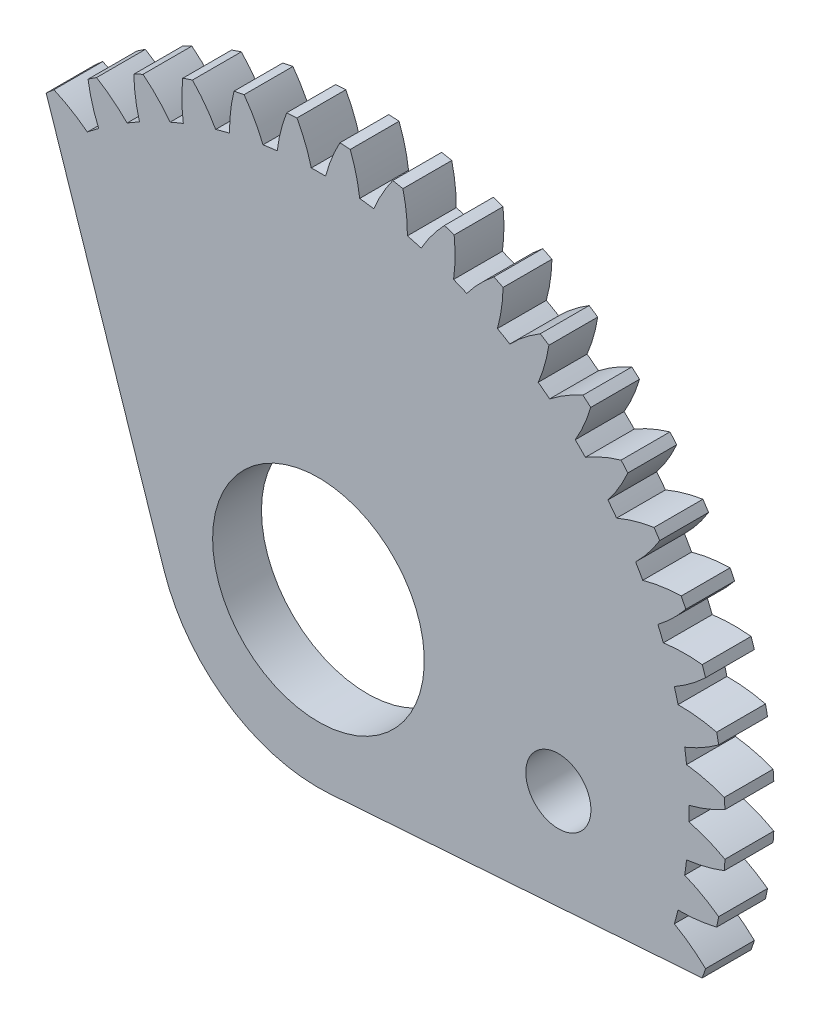
from build123d import *

# Parameters (mm, degrees)
EXTRUDE_1_DEPTH     = 5
CUT_EXTRUDE_1_DEPTH = 36.658310631
SKETCH_3_R          = 2.5
CUT_EXTRUDE_2_DEPTH = 36.658310631
SKETCH_4_R          = 3
CUT_EXTRUDE_3_DEPTH = 176.179925108
EXTRUDE_START       = -5
SKETCH_5_R          = 3
SKETCH_5_R_2        = 1.5
EXTRUDE_2_DEPTH     = 5
SKETCH_6_R          = 1.5
CUT_EXTRUDE_4_DEPTH = 36.531888735
SKETCH_7_R          = 10
SKETCH_7_R_2        = 2.5
EXTRUDE_3_DEPTH     = 5
EXTRUDE_4_DEPTH     = 5
SKETCH_9_R          = 6.5
CUT_EXTRUDE_5_DEPTH = 5
SKETCH_10_R         = 2
SKETCH_10_R_2       = 1.5
CUT_EXTRUDE_6_DEPTH = 5
SKETCH_11_R         = 6.5
SKETCH_11_R_2       = 2
CUT_EXTRUDE_7_DEPTH = 2


with BuildPart() as part:
    # 草图1 → 凸台-拉伸1 (new body)
    with BuildSketch(Plane.XY):
        with BuildLine():
            ThreePointArc((-24.965126848, 1.32001571), (-23.882431713, 0.810441639), (-22.744753764, 0.439519311))
            ThreePointArc((-22.744753764, 0.439519311), (-22.749, 0), (-22.744753764, -0.439519311))
            ThreePointArc((-22.744753764, -0.439519311), (-23.882431713, -0.810441639), (-24.965126848, -1.32001571))
            ThreePointArc((-24.965126848, -1.32001571), (-24.946473081, -1.635078231), (-24.923843351, -1.949880153))
            ThreePointArc((-24.923843351, -1.949880153), (-23.78389806, -2.313774674), (-22.607538024, -2.533026939))
            ThreePointArc((-22.607538024, -2.533026939), (-22.554379151, -2.969340347), (-22.49280046, -3.404545264))
            ThreePointArc((-22.49280046, -3.404545264), (-23.572330338, -3.920791071), (-24.579250102, -4.567325739))
            ThreePointArc((-24.579250102, -4.567325739), (-24.51963201, -4.87725805), (-24.456105984, -5.186413026))
            ThreePointArc((-24.456105984, -5.186413026), (-23.278415317, -5.398401661), (-22.083501041, -5.462232396))
            ThreePointArc((-22.083501041, -5.462232396), (-21.973846622, -5.887874457), (-21.855989105, -6.311318504))
            ThreePointArc((-21.855989105, -6.311318504), (-22.858899855, -6.964054681), (-23.772815573, -7.736487557))
            ThreePointArc((-23.772815573, -7.736487557), (-23.673253237, -8.035986633), (-23.569917864, -8.334204934))
            ThreePointArc((-23.569917864, -8.334204934), (-22.374632434, -8.390660498), (-21.181609233, -8.297977543))
            ThreePointArc((-21.181609233, -8.297977543), (-21.017335485, -8.705665403), (-20.845215716, -9.110103334))
            ThreePointArc((-20.845215716, -9.110103334), (-21.754347258, -9.888161384), (-22.559621578, -10.773275929))
            ThreePointArc((-22.559621578, -10.773275929), (-22.421818538, -11.057217255), (-22.280441914, -11.339396285))
            ThreePointArc((-22.280441914, -11.339396285), (-21.088013387, -11.239352809), (-19.917294218, -10.991741993))
            ThreePointArc((-19.917294218, -10.991741993), (-19.701211911, -11.3745), (-19.477774907, -11.753011771))
            ThreePointArc((-19.477774907, -11.753011771), (-20.277571748, -12.643078904), (-20.960426204, -13.625730562))
            ThreePointArc((-20.960426204, -13.625730562), (-20.786740308, -13.889255825), (-20.609741426, -14.150567422))
            ThreePointArc((-20.609741426, -14.150567422), (-19.440572584, -13.895736676), (-18.312188777, -13.49743469))
            ThreePointArc((-18.312188777, -13.49743469), (-18.047995138, -13.848713749), (-17.777063969, -14.194822917))
            ThreePointArc((-17.777063969, -14.194822917), (-18.453841363, -15.181669839), (-19.002592125, -16.245045168))
            ThreePointArc((-19.002592125, -16.245045168), (-18.795995187, -16.483645378), (-18.586402547, -16.719618427))
            ThreePointArc((-18.586402547, -16.719618427), (-17.460498194, -16.314360637), (-16.393756708, -15.772182537))
            ThreePointArc((-16.393756708, -15.772182537), (-16.085972165, -16.085972165), (-15.772182537, -16.393756708))
            ThreePointArc((-15.772182537, -16.393756708), (-16.314360637, -17.460498194), (-16.719618427, -18.586402547))
            ThreePointArc((-16.719618427, -18.586402547), (-16.483645378, -18.795995187), (-16.245045168, -19.002592125))
            ThreePointArc((-16.245045168, -19.002592125), (-15.181669839, -18.453841363), (-14.194822917, -17.777063969))
            ThreePointArc((-14.194822917, -17.777063969), (-13.848713749, -18.047995138), (-13.49743469, -18.312188777))
            ThreePointArc((-13.49743469, -18.312188777), (-13.895736676, -19.440572584), (-14.150567422, -20.609741426))
            ThreePointArc((-14.150567422, -20.609741426), (-13.889255825, -20.786740308), (-13.625730562, -20.960426204))
            ThreePointArc((-13.625730562, -20.960426204), (-12.643078904, -20.277571748), (-11.753011771, -19.477774907))
            ThreePointArc((-11.753011771, -19.477774907), (-11.3745, -19.701211911), (-10.991741993, -19.917294218))
            ThreePointArc((-10.991741993, -19.917294218), (-11.239352809, -21.088013387), (-11.339396285, -22.280441914))
            ThreePointArc((-11.339396285, -22.280441914), (-11.057217255, -22.421818538), (-10.773275929, -22.559621578))
            ThreePointArc((-10.773275929, -22.559621578), (-9.888161384, -21.754347258), (-9.110103334, -20.845215716))
            ThreePointArc((-9.110103334, -20.845215716), (-8.705665403, -21.017335485), (-8.297977543, -21.181609233))
            ThreePointArc((-8.297977543, -21.181609233), (-8.390660498, -22.374632434), (-8.334204934, -23.569917864))
            ThreePointArc((-8.334204934, -23.569917864), (-8.035986633, -23.673253237), (-7.736487557, -23.772815573))
            ThreePointArc((-7.736487557, -23.772815573), (-6.964054681, -22.858899855), (-6.311318504, -21.855989105))
            ThreePointArc((-6.311318504, -21.855989105), (-5.887874457, -21.973846622), (-5.462232396, -22.083501041))
            ThreePointArc((-5.462232396, -22.083501041), (-5.398401661, -23.278415317), (-5.186413026, -24.456105984))
            ThreePointArc((-5.186413026, -24.456105984), (-4.87725805, -24.51963201), (-4.567325739, -24.579250102))
            ThreePointArc((-4.567325739, -24.579250102), (-3.920791071, -23.572330338), (-3.404545264, -22.49280046))
            ThreePointArc((-3.404545264, -22.49280046), (-2.969340347, -22.554379151), (-2.533026939, -22.607538024))
            ThreePointArc((-2.533026939, -22.607538024), (-2.313774674, -23.78389806), (-1.949880153, -24.923843351))
            ThreePointArc((-1.949880153, -24.923843351), (-1.635078231, -24.946473081), (-1.32001571, -24.965126848))
            ThreePointArc((-1.32001571, -24.965126848), (-0.810441639, -23.882431713), (-0.439519311, -22.744753764))
            ThreePointArc((-0.439519311, -22.744753764), (0, -22.749), (0.439519311, -22.744753764))
            ThreePointArc((0.439519311, -22.744753764), (0.810441639, -23.882431713), (1.32001571, -24.965126848))
            ThreePointArc((1.32001571, -24.965126848), (1.635078231, -24.946473081), (1.949880153, -24.923843351))
            ThreePointArc((1.949880153, -24.923843351), (2.313774674, -23.78389806), (2.533026939, -22.607538024))
            ThreePointArc((2.533026939, -22.607538024), (2.969340347, -22.554379151), (3.404545264, -22.49280046))
            ThreePointArc((3.404545264, -22.49280046), (3.920791071, -23.572330338), (4.567325739, -24.579250102))
            ThreePointArc((4.567325739, -24.579250102), (4.87725805, -24.51963201), (5.186413026, -24.456105984))
            ThreePointArc((5.186413026, -24.456105984), (5.398401661, -23.278415317), (5.462232396, -22.083501041))
            ThreePointArc((5.462232396, -22.083501041), (5.887874457, -21.973846622), (6.311318504, -21.855989105))
            ThreePointArc((6.311318504, -21.855989105), (6.964054681, -22.858899855), (7.736487557, -23.772815573))
            ThreePointArc((7.736487557, -23.772815573), (8.035986633, -23.673253237), (8.334204934, -23.569917864))
            ThreePointArc((8.334204934, -23.569917864), (8.390660498, -22.374632434), (8.297977543, -21.181609233))
            ThreePointArc((8.297977543, -21.181609233), (8.705665403, -21.017335485), (9.110103334, -20.845215716))
            ThreePointArc((9.110103334, -20.845215716), (9.888161384, -21.754347258), (10.773275929, -22.559621578))
            ThreePointArc((10.773275929, -22.559621578), (11.057217255, -22.421818538), (11.339396285, -22.280441914))
            ThreePointArc((11.339396285, -22.280441914), (11.239352809, -21.088013387), (10.991741993, -19.917294218))
            ThreePointArc((10.991741993, -19.917294218), (11.3745, -19.701211911), (11.753011771, -19.477774907))
            ThreePointArc((11.753011771, -19.477774907), (12.643078904, -20.277571748), (13.625730562, -20.960426204))
            ThreePointArc((13.625730562, -20.960426204), (13.889255825, -20.786740308), (14.150567422, -20.609741426))
            ThreePointArc((14.150567422, -20.609741426), (13.895736676, -19.440572584), (13.49743469, -18.312188777))
            ThreePointArc((13.49743469, -18.312188777), (13.848713749, -18.047995138), (14.194822917, -17.777063969))
            ThreePointArc((14.194822917, -17.777063969), (15.181669839, -18.453841363), (16.245045168, -19.002592125))
            ThreePointArc((16.245045168, -19.002592125), (16.483645378, -18.795995187), (16.719618427, -18.586402547))
            ThreePointArc((16.719618427, -18.586402547), (16.314360637, -17.460498194), (15.772182537, -16.393756708))
            ThreePointArc((15.772182537, -16.393756708), (16.085972165, -16.085972165), (16.393756708, -15.772182537))
            ThreePointArc((16.393756708, -15.772182537), (17.460498194, -16.314360637), (18.586402547, -16.719618427))
            ThreePointArc((18.586402547, -16.719618427), (18.795995187, -16.483645378), (19.002592125, -16.245045168))
            ThreePointArc((19.002592125, -16.245045168), (18.453841363, -15.181669839), (17.777063969, -14.194822917))
            ThreePointArc((17.777063969, -14.194822917), (18.047995138, -13.848713749), (18.312188777, -13.49743469))
            ThreePointArc((18.312188777, -13.49743469), (19.440572584, -13.895736676), (20.609741426, -14.150567422))
            ThreePointArc((20.609741426, -14.150567422), (20.786740308, -13.889255825), (20.960426204, -13.625730562))
            ThreePointArc((20.960426204, -13.625730562), (20.277571748, -12.643078904), (19.477774907, -11.753011771))
            ThreePointArc((19.477774907, -11.753011771), (19.701211911, -11.3745), (19.917294218, -10.991741993))
            ThreePointArc((19.917294218, -10.991741993), (21.088013387, -11.239352809), (22.280441914, -11.339396285))
            ThreePointArc((22.280441914, -11.339396285), (22.421818538, -11.057217255), (22.559621578, -10.773275929))
            ThreePointArc((22.559621578, -10.773275929), (21.754347258, -9.888161384), (20.845215716, -9.110103334))
            ThreePointArc((20.845215716, -9.110103334), (21.017335485, -8.705665403), (21.181609233, -8.297977543))
            ThreePointArc((21.181609233, -8.297977543), (22.374632434, -8.390660498), (23.569917864, -8.334204934))
            ThreePointArc((23.569917864, -8.334204934), (23.673253237, -8.035986633), (23.772815573, -7.736487557))
            ThreePointArc((23.772815573, -7.736487557), (22.858899855, -6.964054681), (21.855989105, -6.311318504))
            ThreePointArc((21.855989105, -6.311318504), (21.973846622, -5.887874457), (22.083501041, -5.462232396))
            ThreePointArc((22.083501041, -5.462232396), (23.278415317, -5.398401661), (24.456105984, -5.186413026))
            ThreePointArc((24.456105984, -5.186413026), (24.51963201, -4.87725805), (24.579250102, -4.567325739))
            ThreePointArc((24.579250102, -4.567325739), (23.572330338, -3.920791071), (22.49280046, -3.404545264))
            ThreePointArc((22.49280046, -3.404545264), (22.554379151, -2.969340347), (22.607538024, -2.533026939))
            ThreePointArc((22.607538024, -2.533026939), (23.78389806, -2.313774674), (24.923843351, -1.949880153))
            ThreePointArc((24.923843351, -1.949880153), (24.946473081, -1.635078231), (24.965126848, -1.32001571))
            ThreePointArc((24.965126848, -1.32001571), (23.882431713, -0.810441639), (22.744753764, -0.439519311))
            ThreePointArc((22.744753764, -0.439519311), (22.749, 0), (22.744753764, 0.439519311))
            ThreePointArc((22.744753764, 0.439519311), (23.882431713, 0.810441639), (24.965126848, 1.32001571))
            ThreePointArc((24.965126848, 1.32001571), (24.946473081, 1.635078231), (24.923843351, 1.949880153))
            ThreePointArc((24.923843351, 1.949880153), (23.78389806, 2.313774674), (22.607538024, 2.533026939))
            ThreePointArc((22.607538024, 2.533026939), (22.554379151, 2.969340347), (22.49280046, 3.404545264))
            ThreePointArc((22.49280046, 3.404545264), (23.572330338, 3.920791071), (24.579250102, 4.567325739))
            ThreePointArc((24.579250102, 4.567325739), (24.51963201, 4.87725805), (24.456105984, 5.186413026))
            ThreePointArc((24.456105984, 5.186413026), (23.278415317, 5.398401661), (22.083501041, 5.462232396))
            ThreePointArc((22.083501041, 5.462232396), (21.973846622, 5.887874457), (21.855989105, 6.311318504))
            ThreePointArc((21.855989105, 6.311318504), (22.858899855, 6.964054681), (23.772815573, 7.736487557))
            ThreePointArc((23.772815573, 7.736487557), (23.673253237, 8.035986633), (23.569917864, 8.334204934))
            ThreePointArc((23.569917864, 8.334204934), (22.374632434, 8.390660498), (21.181609233, 8.297977543))
            ThreePointArc((21.181609233, 8.297977543), (21.017335485, 8.705665403), (20.845215716, 9.110103334))
            ThreePointArc((20.845215716, 9.110103334), (21.754347258, 9.888161384), (22.559621578, 10.773275929))
            ThreePointArc((22.559621578, 10.773275929), (22.421818538, 11.057217255), (22.280441914, 11.339396285))
            ThreePointArc((22.280441914, 11.339396285), (21.088013387, 11.239352809), (19.917294218, 10.991741993))
            ThreePointArc((19.917294218, 10.991741993), (19.701211911, 11.3745), (19.477774907, 11.753011771))
            ThreePointArc((19.477774907, 11.753011771), (20.277571748, 12.643078904), (20.960426204, 13.625730562))
            ThreePointArc((20.960426204, 13.625730562), (20.786740308, 13.889255825), (20.609741426, 14.150567422))
            ThreePointArc((20.609741426, 14.150567422), (19.440572584, 13.895736676), (18.312188777, 13.49743469))
            ThreePointArc((18.312188777, 13.49743469), (18.047995138, 13.848713749), (17.777063969, 14.194822917))
            ThreePointArc((17.777063969, 14.194822917), (18.453841363, 15.181669839), (19.002592125, 16.245045168))
            ThreePointArc((19.002592125, 16.245045168), (18.795995187, 16.483645378), (18.586402547, 16.719618427))
            ThreePointArc((18.586402547, 16.719618427), (17.460498194, 16.314360637), (16.393756708, 15.772182537))
            ThreePointArc((16.393756708, 15.772182537), (16.085972165, 16.085972165), (15.772182537, 16.393756708))
            ThreePointArc((15.772182537, 16.393756708), (16.314360637, 17.460498194), (16.719618427, 18.586402547))
            ThreePointArc((16.719618427, 18.586402547), (16.483645378, 18.795995187), (16.245045168, 19.002592125))
            ThreePointArc((16.245045168, 19.002592125), (15.181669839, 18.453841363), (14.194822917, 17.777063969))
            ThreePointArc((14.194822917, 17.777063969), (13.848713749, 18.047995138), (13.49743469, 18.312188777))
            ThreePointArc((13.49743469, 18.312188777), (13.895736676, 19.440572584), (14.150567422, 20.609741426))
            ThreePointArc((14.150567422, 20.609741426), (13.889255825, 20.786740308), (13.625730562, 20.960426204))
            ThreePointArc((13.625730562, 20.960426204), (12.643078904, 20.277571748), (11.753011771, 19.477774907))
            ThreePointArc((11.753011771, 19.477774907), (11.3745, 19.701211911), (10.991741993, 19.917294218))
            ThreePointArc((10.991741993, 19.917294218), (11.239352809, 21.088013387), (11.339396285, 22.280441914))
            ThreePointArc((11.339396285, 22.280441914), (11.057217255, 22.421818538), (10.773275929, 22.559621578))
            ThreePointArc((10.773275929, 22.559621578), (9.888161384, 21.754347258), (9.110103334, 20.845215716))
            ThreePointArc((9.110103334, 20.845215716), (8.705665403, 21.017335485), (8.297977543, 21.181609233))
            ThreePointArc((8.297977543, 21.181609233), (8.390660498, 22.374632434), (8.334204934, 23.569917864))
            ThreePointArc((8.334204934, 23.569917864), (8.035986633, 23.673253237), (7.736487557, 23.772815573))
            ThreePointArc((7.736487557, 23.772815573), (6.964054681, 22.858899855), (6.311318504, 21.855989105))
            ThreePointArc((6.311318504, 21.855989105), (5.887874457, 21.973846622), (5.462232396, 22.083501041))
            ThreePointArc((5.462232396, 22.083501041), (5.398401661, 23.278415317), (5.186413026, 24.456105984))
            ThreePointArc((5.186413026, 24.456105984), (4.87725805, 24.51963201), (4.567325739, 24.579250102))
            ThreePointArc((4.567325739, 24.579250102), (3.920791071, 23.572330338), (3.404545264, 22.49280046))
            ThreePointArc((3.404545264, 22.49280046), (2.969340347, 22.554379151), (2.533026939, 22.607538024))
            ThreePointArc((2.533026939, 22.607538024), (2.313774674, 23.78389806), (1.949880153, 24.923843351))
            ThreePointArc((1.949880153, 24.923843351), (1.635078231, 24.946473081), (1.32001571, 24.965126848))
            ThreePointArc((1.32001571, 24.965126848), (0.810441639, 23.882431713), (0.439519311, 22.744753764))
            ThreePointArc((0.439519311, 22.744753764), (0, 22.749), (-0.439519311, 22.744753764))
            ThreePointArc((-0.439519311, 22.744753764), (-0.810441639, 23.882431713), (-1.32001571, 24.965126848))
            ThreePointArc((-1.32001571, 24.965126848), (-1.635078231, 24.946473081), (-1.949880153, 24.923843351))
            ThreePointArc((-1.949880153, 24.923843351), (-2.313774674, 23.78389806), (-2.533026939, 22.607538024))
            ThreePointArc((-2.533026939, 22.607538024), (-2.969340347, 22.554379151), (-3.404545264, 22.49280046))
            ThreePointArc((-3.404545264, 22.49280046), (-3.920791071, 23.572330338), (-4.567325739, 24.579250102))
            ThreePointArc((-4.567325739, 24.579250102), (-4.87725805, 24.51963201), (-5.186413026, 24.456105984))
            ThreePointArc((-5.186413026, 24.456105984), (-5.398401661, 23.278415317), (-5.462232396, 22.083501041))
            ThreePointArc((-5.462232396, 22.083501041), (-5.887874457, 21.973846622), (-6.311318504, 21.855989105))
            ThreePointArc((-6.311318504, 21.855989105), (-6.964054681, 22.858899855), (-7.736487557, 23.772815573))
            ThreePointArc((-7.736487557, 23.772815573), (-8.035986633, 23.673253237), (-8.334204934, 23.569917864))
            ThreePointArc((-8.334204934, 23.569917864), (-8.390660498, 22.374632434), (-8.297977543, 21.181609233))
            ThreePointArc((-8.297977543, 21.181609233), (-8.705665403, 21.017335485), (-9.110103334, 20.845215716))
            ThreePointArc((-9.110103334, 20.845215716), (-9.888161384, 21.754347258), (-10.773275929, 22.559621578))
            ThreePointArc((-10.773275929, 22.559621578), (-11.057217255, 22.421818538), (-11.339396285, 22.280441914))
            ThreePointArc((-11.339396285, 22.280441914), (-11.239352809, 21.088013387), (-10.991741993, 19.917294218))
            ThreePointArc((-10.991741993, 19.917294218), (-11.3745, 19.701211911), (-11.753011771, 19.477774907))
            ThreePointArc((-11.753011771, 19.477774907), (-12.643078904, 20.277571748), (-13.625730562, 20.960426204))
            ThreePointArc((-13.625730562, 20.960426204), (-13.889255825, 20.786740308), (-14.150567422, 20.609741426))
            ThreePointArc((-14.150567422, 20.609741426), (-13.895736676, 19.440572584), (-13.49743469, 18.312188777))
            ThreePointArc((-13.49743469, 18.312188777), (-13.848713749, 18.047995138), (-14.194822917, 17.777063969))
            ThreePointArc((-14.194822917, 17.777063969), (-15.181669839, 18.453841363), (-16.245045168, 19.002592125))
            ThreePointArc((-16.245045168, 19.002592125), (-16.483645378, 18.795995187), (-16.719618427, 18.586402547))
            ThreePointArc((-16.719618427, 18.586402547), (-16.314360637, 17.460498194), (-15.772182537, 16.393756708))
            ThreePointArc((-15.772182537, 16.393756708), (-16.085972165, 16.085972165), (-16.393756708, 15.772182537))
            ThreePointArc((-16.393756708, 15.772182537), (-17.460498194, 16.314360637), (-18.586402547, 16.719618427))
            ThreePointArc((-18.586402547, 16.719618427), (-18.795995187, 16.483645378), (-19.002592125, 16.245045168))
            ThreePointArc((-19.002592125, 16.245045168), (-18.453841363, 15.181669839), (-17.777063969, 14.194822917))
            ThreePointArc((-17.777063969, 14.194822917), (-18.047995138, 13.848713749), (-18.312188777, 13.49743469))
            ThreePointArc((-18.312188777, 13.49743469), (-19.440572584, 13.895736676), (-20.609741426, 14.150567422))
            ThreePointArc((-20.609741426, 14.150567422), (-20.786740308, 13.889255825), (-20.960426204, 13.625730562))
            ThreePointArc((-20.960426204, 13.625730562), (-20.277571748, 12.643078904), (-19.477774907, 11.753011771))
            ThreePointArc((-19.477774907, 11.753011771), (-19.701211911, 11.3745), (-19.917294218, 10.991741993))
            ThreePointArc((-19.917294218, 10.991741993), (-21.088013387, 11.239352809), (-22.280441914, 11.339396285))
            ThreePointArc((-22.280441914, 11.339396285), (-22.421818538, 11.057217255), (-22.559621578, 10.773275929))
            ThreePointArc((-22.559621578, 10.773275929), (-21.754347258, 9.888161384), (-20.845215716, 9.110103334))
            ThreePointArc((-20.845215716, 9.110103334), (-21.017335485, 8.705665403), (-21.181609233, 8.297977543))
            ThreePointArc((-21.181609233, 8.297977543), (-22.374632434, 8.390660498), (-23.569917864, 8.334204934))
            ThreePointArc((-23.569917864, 8.334204934), (-23.673253237, 8.035986633), (-23.772815573, 7.736487557))
            ThreePointArc((-23.772815573, 7.736487557), (-22.858899855, 6.964054681), (-21.855989105, 6.311318504))
            ThreePointArc((-21.855989105, 6.311318504), (-21.973846622, 5.887874457), (-22.083501041, 5.462232396))
            ThreePointArc((-22.083501041, 5.462232396), (-23.278415317, 5.398401661), (-24.456105984, 5.186413026))
            ThreePointArc((-24.456105984, 5.186413026), (-24.51963201, 4.87725805), (-24.579250102, 4.567325739))
            ThreePointArc((-24.579250102, 4.567325739), (-23.572330338, 3.920791071), (-22.49280046, 3.404545264))
            ThreePointArc((-22.49280046, 3.404545264), (-22.554379151, 2.969340347), (-22.607538024, 2.533026939))
            ThreePointArc((-22.607538024, 2.533026939), (-23.78389806, 2.313774674), (-24.923843351, 1.949880153))
            ThreePointArc((-24.923843351, 1.949880153), (-24.946473081, 1.635078231), (-24.965126848, 1.32001571))
        make_face()
    extrude(amount=EXTRUDE_1_DEPTH)

    # 草图2 → 切除-拉伸1 (cut, through all)
    with BuildSketch(Plane(origin=(0, 0, 0), x_dir=(-1, 0, 0), z_dir=(0, 0, -1))):
        with BuildLine():
            Line((0.423916397, -6.98715213), (-21.181609233, -8.297977543))
            ThreePointArc((-21.181609233, -8.297977543), (-21.017335485, -8.705665403), (-20.845215716, -9.110103334))
            ThreePointArc((-20.845215716, -9.110103334), (-21.754347258, -9.888161384), (-22.559621578, -10.773275929))
            ThreePointArc((-22.559621578, -10.773275929), (-22.421818538, -11.057217255), (-22.280441914, -11.339396285))
            ThreePointArc((-22.280441914, -11.339396285), (-21.088013387, -11.239352809), (-19.917294218, -10.991741993))
            ThreePointArc((-19.917294218, -10.991741993), (-19.701211911, -11.3745), (-19.477774907, -11.753011771))
            ThreePointArc((-19.477774907, -11.753011771), (-20.277571748, -12.643078904), (-20.960426204, -13.625730562))
            ThreePointArc((-20.960426204, -13.625730562), (-20.786740308, -13.889255825), (-20.609741426, -14.150567422))
            ThreePointArc((-20.609741426, -14.150567422), (-19.440572584, -13.895736676), (-18.312188777, -13.49743469))
            ThreePointArc((-18.312188777, -13.49743469), (-18.047995138, -13.848713749), (-17.777063969, -14.194822917))
            ThreePointArc((-17.777063969, -14.194822917), (-18.453841363, -15.181669839), (-19.002592125, -16.245045168))
            ThreePointArc((-19.002592125, -16.245045168), (-18.795995187, -16.483645378), (-18.586402547, -16.719618427))
            ThreePointArc((-18.586402547, -16.719618427), (-17.460498194, -16.314360637), (-16.393756708, -15.772182537))
            ThreePointArc((-16.393756708, -15.772182537), (-16.085972165, -16.085972165), (-15.772182537, -16.393756708))
            ThreePointArc((-15.772182537, -16.393756708), (-16.314360637, -17.460498194), (-16.719618427, -18.586402547))
            ThreePointArc((-16.719618427, -18.586402547), (-16.483645378, -18.795995187), (-16.245045168, -19.002592125))
            ThreePointArc((-16.245045168, -19.002592125), (-15.181669839, -18.453841363), (-14.194822917, -17.777063969))
            ThreePointArc((-14.194822917, -17.777063969), (-13.848713749, -18.047995138), (-13.49743469, -18.312188777))
            ThreePointArc((-13.49743469, -18.312188777), (-13.895736676, -19.440572584), (-14.150567422, -20.609741426))
            ThreePointArc((-14.150567422, -20.609741426), (-13.889255825, -20.786740308), (-13.625730562, -20.960426204))
            ThreePointArc((-13.625730562, -20.960426204), (-12.643078904, -20.277571748), (-11.753011771, -19.477774907))
            ThreePointArc((-11.753011771, -19.477774907), (-11.3745, -19.701211911), (-10.991741993, -19.917294218))
            ThreePointArc((-10.991741993, -19.917294218), (-11.239352809, -21.088013387), (-11.339396285, -22.280441914))
            ThreePointArc((-11.339396285, -22.280441914), (-11.057217255, -22.421818538), (-10.773275929, -22.559621578))
            ThreePointArc((-10.773275929, -22.559621578), (-9.888161384, -21.754347258), (-9.110103334, -20.845215716))
            ThreePointArc((-9.110103334, -20.845215716), (-8.705665403, -21.017335485), (-8.297977543, -21.181609233))
            ThreePointArc((-8.297977543, -21.181609233), (-8.390660498, -22.374632434), (-8.334204934, -23.569917864))
            ThreePointArc((-8.334204934, -23.569917864), (-8.035986633, -23.673253237), (-7.736487557, -23.772815573))
            ThreePointArc((-7.736487557, -23.772815573), (-6.964054681, -22.858899855), (-6.311318504, -21.855989105))
            ThreePointArc((-6.311318504, -21.855989105), (-5.887874457, -21.973846622), (-5.462232396, -22.083501041))
            ThreePointArc((-5.462232396, -22.083501041), (-5.398401661, -23.278415317), (-5.186413026, -24.456105984))
            ThreePointArc((-5.186413026, -24.456105984), (-4.87725805, -24.51963201), (-4.567325739, -24.579250102))
            ThreePointArc((-4.567325739, -24.579250102), (-3.920791071, -23.572330338), (-3.404545264, -22.49280046))
            ThreePointArc((-3.404545264, -22.49280046), (-2.969340347, -22.554379151), (-2.533026939, -22.607538024))
            ThreePointArc((-2.533026939, -22.607538024), (-2.313774674, -23.78389806), (-1.949880153, -24.923843351))
            ThreePointArc((-1.949880153, -24.923843351), (-1.635078231, -24.946473081), (-1.32001571, -24.965126848))
            ThreePointArc((-1.32001571, -24.965126848), (-0.810441639, -23.882431713), (-0.439519311, -22.744753764))
            ThreePointArc((-0.439519311, -22.744753764), (0, -22.749), (0.439519311, -22.744753764))
            ThreePointArc((0.439519311, -22.744753764), (0.810441639, -23.882431713), (1.32001571, -24.965126848))
            ThreePointArc((1.32001571, -24.965126848), (1.635078231, -24.946473081), (1.949880153, -24.923843351))
            ThreePointArc((1.949880153, -24.923843351), (2.313774674, -23.78389806), (2.533026939, -22.607538024))
            ThreePointArc((2.533026939, -22.607538024), (2.969340347, -22.554379151), (3.404545264, -22.49280046))
            ThreePointArc((3.404545264, -22.49280046), (3.920791071, -23.572330338), (4.567325739, -24.579250102))
            ThreePointArc((4.567325739, -24.579250102), (4.87725805, -24.51963201), (5.186413026, -24.456105984))
            ThreePointArc((5.186413026, -24.456105984), (5.398401661, -23.278415317), (5.462232396, -22.083501041))
            ThreePointArc((5.462232396, -22.083501041), (5.887874457, -21.973846622), (6.311318504, -21.855989105))
            ThreePointArc((6.311318504, -21.855989105), (6.964054681, -22.858899855), (7.736487557, -23.772815573))
            ThreePointArc((7.736487557, -23.772815573), (8.035986633, -23.673253237), (8.334204934, -23.569917864))
            ThreePointArc((8.334204934, -23.569917864), (8.390660498, -22.374632434), (8.297977543, -21.181609233))
            ThreePointArc((8.297977543, -21.181609233), (8.705665403, -21.017335485), (9.110103334, -20.845215716))
            ThreePointArc((9.110103334, -20.845215716), (9.888161384, -21.754347258), (10.773275929, -22.559621578))
            ThreePointArc((10.773275929, -22.559621578), (11.057217255, -22.421818538), (11.339396285, -22.280441914))
            ThreePointArc((11.339396285, -22.280441914), (11.239352809, -21.088013387), (10.991741993, -19.917294218))
            ThreePointArc((10.991741993, -19.917294218), (11.3745, -19.701211911), (11.753011771, -19.477774907))
            ThreePointArc((11.753011771, -19.477774907), (12.643078904, -20.277571748), (13.625730562, -20.960426204))
            ThreePointArc((13.625730562, -20.960426204), (13.889255825, -20.786740308), (14.150567422, -20.609741426))
            ThreePointArc((14.150567422, -20.609741426), (13.895736676, -19.440572584), (13.49743469, -18.312188777))
            ThreePointArc((13.49743469, -18.312188777), (13.848713749, -18.047995138), (14.194822917, -17.777063969))
            ThreePointArc((14.194822917, -17.777063969), (15.181669839, -18.453841363), (16.245045168, -19.002592125))
            ThreePointArc((16.245045168, -19.002592125), (16.483645378, -18.795995187), (16.719618427, -18.586402547))
            ThreePointArc((16.719618427, -18.586402547), (16.314360637, -17.460498194), (15.772182537, -16.393756708))
            ThreePointArc((15.772182537, -16.393756708), (16.085972165, -16.085972165), (16.393756708, -15.772182537))
            ThreePointArc((16.393756708, -15.772182537), (17.460498194, -16.314360637), (18.586402547, -16.719618427))
            ThreePointArc((18.586402547, -16.719618427), (18.795995187, -16.483645378), (19.002592125, -16.245045168))
            ThreePointArc((19.002592125, -16.245045168), (18.453841363, -15.181669839), (17.777063969, -14.194822917))
            ThreePointArc((17.777063969, -14.194822917), (18.047995138, -13.848713749), (18.312188777, -13.49743469))
            ThreePointArc((18.312188777, -13.49743469), (19.440572584, -13.895736676), (20.609741426, -14.150567422))
            ThreePointArc((20.609741426, -14.150567422), (20.786740308, -13.889255825), (20.960426204, -13.625730562))
            ThreePointArc((20.960426204, -13.625730562), (20.277571748, -12.643078904), (19.477774907, -11.753011771))
            ThreePointArc((19.477774907, -11.753011771), (19.701211911, -11.3745), (19.917294218, -10.991741993))
            ThreePointArc((19.917294218, -10.991741993), (21.088013387, -11.239352809), (22.280441914, -11.339396285))
            ThreePointArc((22.280441914, -11.339396285), (22.421818538, -11.057217255), (22.559621578, -10.773275929))
            ThreePointArc((22.559621578, -10.773275929), (21.754347258, -9.888161384), (20.845215716, -9.110103334))
            ThreePointArc((20.845215716, -9.110103334), (21.017335485, -8.705665403), (21.181609233, -8.297977543))
            ThreePointArc((21.181609233, -8.297977543), (22.374632434, -8.390660498), (23.569917864, -8.334204934))
            ThreePointArc((23.569917864, -8.334204934), (23.673253237, -8.035986633), (23.772815573, -7.736487557))
            ThreePointArc((23.772815573, -7.736487557), (22.858899855, -6.964054681), (21.855989105, -6.311318504))
            ThreePointArc((21.855989105, -6.311318504), (21.973846622, -5.887874457), (22.083501041, -5.462232396))
            ThreePointArc((22.083501041, -5.462232396), (23.278415317, -5.398401661), (24.456105984, -5.186413026))
            ThreePointArc((24.456105984, -5.186413026), (24.51963201, -4.87725805), (24.579250102, -4.567325739))
            ThreePointArc((24.579250102, -4.567325739), (23.572330338, -3.920791071), (22.49280046, -3.404545264))
            ThreePointArc((22.49280046, -3.404545264), (22.554379151, -2.969340347), (22.607538024, -2.533026939))
            ThreePointArc((22.607538024, -2.533026939), (23.78389806, -2.313774674), (24.923843351, -1.949880153))
            ThreePointArc((24.923843351, -1.949880153), (24.946473081, -1.635078231), (24.965126848, -1.32001571))
            ThreePointArc((24.965126848, -1.32001571), (23.882431713, -0.810441639), (22.744753764, -0.439519311))
            ThreePointArc((22.744753764, -0.439519311), (22.749, 0), (22.744753764, 0.439519311))
            ThreePointArc((22.744753764, 0.439519311), (23.882431713, 0.810441639), (24.965126848, 1.32001571))
            ThreePointArc((24.965126848, 1.32001571), (24.946473081, 1.635078231), (24.923843351, 1.949880153))
            ThreePointArc((24.923843351, 1.949880153), (23.78389806, 2.313774674), (22.607538024, 2.533026939))
            ThreePointArc((22.607538024, 2.533026939), (22.554379151, 2.969340347), (22.49280046, 3.404545264))
            ThreePointArc((22.49280046, 3.404545264), (23.572330338, 3.920791071), (24.579250102, 4.567325739))
            ThreePointArc((24.579250102, 4.567325739), (24.51963201, 4.87725805), (24.456105984, 5.186413026))
            ThreePointArc((24.456105984, 5.186413026), (23.278415317, 5.398401661), (22.083501041, 5.462232396))
            ThreePointArc((22.083501041, 5.462232396), (21.973846622, 5.887874457), (21.855989105, 6.311318504))
            ThreePointArc((21.855989105, 6.311318504), (22.858899855, 6.964054681), (23.772815573, 7.736487557))
            ThreePointArc((23.772815573, 7.736487557), (23.673253237, 8.035986633), (23.569917864, 8.334204934))
            ThreePointArc((23.569917864, 8.334204934), (22.374632434, 8.390660498), (21.181609233, 8.297977543))
            ThreePointArc((21.181609233, 8.297977543), (21.017335485, 8.705665403), (20.845215716, 9.110103334))
            ThreePointArc((20.845215716, 9.110103334), (21.754347258, 9.888161384), (22.559621578, 10.773275929))
            ThreePointArc((22.559621578, 10.773275929), (22.421818538, 11.057217255), (22.280441914, 11.339396285))
            ThreePointArc((22.280441914, 11.339396285), (21.088013387, 11.239352809), (19.917294218, 10.991741993))
            ThreePointArc((19.917294218, 10.991741993), (19.701211911, 11.3745), (19.477774907, 11.753011771))
            ThreePointArc((19.477774907, 11.753011771), (20.277571748, 12.643078904), (20.960426204, 13.625730562))
            ThreePointArc((20.960426204, 13.625730562), (20.786740308, 13.889255825), (20.609741426, 14.150567422))
            ThreePointArc((20.609741426, 14.150567422), (19.440572584, 13.895736676), (18.312188777, 13.49743469))
            ThreePointArc((18.312188777, 13.49743469), (18.047995138, 13.848713749), (17.777063969, 14.194822917))
            ThreePointArc((17.777063969, 14.194822917), (18.453841363, 15.181669839), (19.002592125, 16.245045168))
            ThreePointArc((19.002592125, 16.245045168), (18.795995187, 16.483645378), (18.586402547, 16.719618427))
            ThreePointArc((18.586402547, 16.719618427), (17.460498194, 16.314360637), (16.393756708, 15.772182537))
            ThreePointArc((16.393756708, 15.772182537), (16.085972165, 16.085972165), (15.772182537, 16.393756708))
            Line((15.772182537, 16.393756708), (6.293061062, -3.065515042))
            ThreePointArc((6.293061062, -3.065515042), (3.888991631, -5.820287286), (0.423916397, -6.98715213))
        make_face()
    extrude(amount=-CUT_EXTRUDE_1_DEPTH, mode=Mode.SUBTRACT)

    # 草图3 → 切除-拉伸2 (cut, through all)
    with BuildSketch(Plane(origin=(0, 0, 0), x_dir=(-1, 0, 0), z_dir=(0, 0, -1))):
        Circle(SKETCH_3_R)
    extrude(amount=-CUT_EXTRUDE_2_DEPTH, mode=Mode.SUBTRACT)

    # 草图4 → 切除-拉伸3 (cut, through all)
    with BuildSketch(Plane(origin=(-80.196400758, -115.081505644, 4), x_dir=(0.7105721913484596, 0.703624303788782, 0), z_dir=(0, 0, 1))):
        with Locations(Location((146.449699756, 12.979655668, 0), (0, 0, 315.281489476))):
            Circle(SKETCH_4_R)
    extrude(amount=-CUT_EXTRUDE_3_DEPTH, mode=Mode.SUBTRACT)

    # 草图5 → 凸台-拉伸2 (add)
    with BuildSketch(Plane(origin=(0, 0, 0), x_dir=(-1, 0, 0), z_dir=(0, 0, -1)).offset(EXTRUDE_START)):
        with Locations((-14.733882136, -2.812955242)):
            Circle(SKETCH_5_R)
        with Locations((-14.733882136, -2.812955242)):
            Circle(SKETCH_5_R_2, mode=Mode.SUBTRACT)
    extrude(amount=EXTRUDE_2_DEPTH)

    # 草图6 → 切除-拉伸4 (cut, through all)
    with BuildSketch(Plane(origin=(0, 0, 4), x_dir=(-1, 0, 0), z_dir=(0, 0, -1))):
        with Locations((-14.733882136, -2.812955242)):
            Circle(SKETCH_6_R)
    extrude(amount=-CUT_EXTRUDE_4_DEPTH, mode=Mode.SUBTRACT)

    # 草图7 → 凸台-拉伸3 (add)
    with BuildSketch(Plane(origin=(0, 0, 0), x_dir=(-1, 0, 0), z_dir=(0, 0, -1))):
        Circle(SKETCH_7_R)
        Circle(SKETCH_7_R_2, mode=Mode.SUBTRACT)
    extrude(amount=-EXTRUDE_3_DEPTH)

    # 草图8 → 凸台-拉伸4 (add)
    with BuildSketch(Plane(origin=(0, 0, 0), x_dir=(-1, 0, 0), z_dir=(0, 0, -1))):
        with BuildLine():
            Line((-6.704404583, -7.41963336), (-21.181609233, -8.297977543))
            ThreePointArc((-21.181609233, -8.297977543), (-22.010852378, -8.378241126), (-22.843931844, -8.38630589))
            Line((-22.843931844, -8.38630589), (-0.715816861, -9.974347408))
            ThreePointArc((-0.715816861, -9.974347408), (-3.923845376, -9.198012691), (-6.704404583, -7.41963336))
        make_face()
        with BuildLine():
            ThreePointArc((9.420511957, 3.354691411), (9.999446282, 0.105233364), (9.489026674, -3.155688955))
            Line((9.489026674, -3.155688955), (16.489930612, 17.895740749))
            ThreePointArc((16.489930612, 17.895740749), (16.163674032, 17.129161934), (15.772182537, 16.393756708))
            Line((15.772182537, 16.393756708), (9.420511957, 3.354691411))
        make_face()
    extrude(amount=-EXTRUDE_4_DEPTH)

    # 草图9 → 切除-拉伸5 (cut)
    with BuildSketch(Plane(origin=(0, 0, 0), x_dir=(-1, 0, 0), z_dir=(0, 0, -1))):
        Circle(SKETCH_9_R)
    extrude(amount=-CUT_EXTRUDE_5_DEPTH, mode=Mode.SUBTRACT)

    # 草图10 → 切除-拉伸6 (cut)
    with BuildSketch(Plane(origin=(0, 0, 0), x_dir=(-1, 0, 0), z_dir=(0, 0, -1))):
        with Locations((-14.733882136, -2.812955242)):
            Circle(SKETCH_10_R)
        with Locations((-14.733882136, -2.812955242)):
            Circle(SKETCH_10_R_2, mode=Mode.SUBTRACT)
    extrude(amount=-CUT_EXTRUDE_6_DEPTH, mode=Mode.SUBTRACT)

    # 草图11 → 切除-拉伸7 (cut)
    with BuildSketch(Plane(origin=(0, 0, 0), x_dir=(-1, 0, 0), z_dir=(0, 0, -1))):
        with BuildLine():
            Line((9.489026674, -3.155688955), (16.489930612, 17.895740749))
            ThreePointArc((16.489930612, 17.895740749), (16.611322451, 18.238894056), (16.719618427, 18.586402547))
            ThreePointArc((16.719618427, 18.586402547), (16.483645378, 18.795995187), (16.245045168, 19.002592125))
            ThreePointArc((16.245045168, 19.002592125), (15.181669839, 18.453841363), (14.194822917, 17.777063969))
            ThreePointArc((14.194822917, 17.777063969), (13.848713749, 18.047995138), (13.49743469, 18.312188777))
            ThreePointArc((13.49743469, 18.312188777), (13.895736676, 19.440572584), (14.150567422, 20.609741426))
            ThreePointArc((14.150567422, 20.609741426), (13.889255825, 20.786740308), (13.625730562, 20.960426204))
            ThreePointArc((13.625730562, 20.960426204), (12.643078904, 20.277571748), (11.753011771, 19.477774907))
            ThreePointArc((11.753011771, 19.477774907), (11.3745, 19.701211911), (10.991741993, 19.917294218))
            ThreePointArc((10.991741993, 19.917294218), (11.239352809, 21.088013387), (11.339396285, 22.280441914))
            ThreePointArc((11.339396285, 22.280441914), (11.057217255, 22.421818538), (10.773275929, 22.559621578))
            ThreePointArc((10.773275929, 22.559621578), (9.888161384, 21.754347258), (9.110103334, 20.845215716))
            ThreePointArc((9.110103334, 20.845215716), (8.705665403, 21.017335485), (8.297977543, 21.181609233))
            ThreePointArc((8.297977543, 21.181609233), (8.390660498, 22.374632434), (8.334204934, 23.569917864))
            ThreePointArc((8.334204934, 23.569917864), (8.035986633, 23.673253237), (7.736487557, 23.772815573))
            ThreePointArc((7.736487557, 23.772815573), (6.964054681, 22.858899855), (6.311318504, 21.855989105))
            ThreePointArc((6.311318504, 21.855989105), (5.887874457, 21.973846622), (5.462232396, 22.083501041))
            ThreePointArc((5.462232396, 22.083501041), (5.398401661, 23.278415317), (5.186413026, 24.456105984))
            ThreePointArc((5.186413026, 24.456105984), (4.87725805, 24.51963201), (4.567325739, 24.579250102))
            ThreePointArc((4.567325739, 24.579250102), (3.920791071, 23.572330338), (3.404545264, 22.49280046))
            ThreePointArc((3.404545264, 22.49280046), (2.969340347, 22.554379151), (2.533026939, 22.607538024))
            ThreePointArc((2.533026939, 22.607538024), (2.313774674, 23.78389806), (1.949880153, 24.923843351))
            ThreePointArc((1.949880153, 24.923843351), (1.635078231, 24.946473081), (1.32001571, 24.965126848))
            ThreePointArc((1.32001571, 24.965126848), (0.810441639, 23.882431713), (0.439519311, 22.744753764))
            ThreePointArc((0.439519311, 22.744753764), (0, 22.749), (-0.439519311, 22.744753764))
            ThreePointArc((-0.439519311, 22.744753764), (-0.810441639, 23.882431713), (-1.32001571, 24.965126848))
            ThreePointArc((-1.32001571, 24.965126848), (-1.635078231, 24.946473081), (-1.949880153, 24.923843351))
            ThreePointArc((-1.949880153, 24.923843351), (-2.313774674, 23.78389806), (-2.533026939, 22.607538024))
            ThreePointArc((-2.533026939, 22.607538024), (-2.969340347, 22.554379151), (-3.404545264, 22.49280046))
            ThreePointArc((-3.404545264, 22.49280046), (-3.920791071, 23.572330338), (-4.567325739, 24.579250102))
            ThreePointArc((-4.567325739, 24.579250102), (-4.87725805, 24.51963201), (-5.186413026, 24.456105984))
            ThreePointArc((-5.186413026, 24.456105984), (-5.398401661, 23.278415317), (-5.462232396, 22.083501041))
            ThreePointArc((-5.462232396, 22.083501041), (-5.887874457, 21.973846622), (-6.311318504, 21.855989105))
            ThreePointArc((-6.311318504, 21.855989105), (-6.964054681, 22.858899855), (-7.736487557, 23.772815573))
            ThreePointArc((-7.736487557, 23.772815573), (-8.035986633, 23.673253237), (-8.334204934, 23.569917864))
            ThreePointArc((-8.334204934, 23.569917864), (-8.390660498, 22.374632434), (-8.297977543, 21.181609233))
            ThreePointArc((-8.297977543, 21.181609233), (-8.705665403, 21.017335485), (-9.110103334, 20.845215716))
            ThreePointArc((-9.110103334, 20.845215716), (-9.888161384, 21.754347258), (-10.773275929, 22.559621578))
            ThreePointArc((-10.773275929, 22.559621578), (-11.057217255, 22.421818538), (-11.339396285, 22.280441914))
            ThreePointArc((-11.339396285, 22.280441914), (-11.239352809, 21.088013387), (-10.991741993, 19.917294218))
            ThreePointArc((-10.991741993, 19.917294218), (-11.3745, 19.701211911), (-11.753011771, 19.477774907))
            ThreePointArc((-11.753011771, 19.477774907), (-12.643078904, 20.277571748), (-13.625730562, 20.960426204))
            ThreePointArc((-13.625730562, 20.960426204), (-13.889255825, 20.786740308), (-14.150567422, 20.609741426))
            ThreePointArc((-14.150567422, 20.609741426), (-13.895736676, 19.440572584), (-13.49743469, 18.312188777))
            ThreePointArc((-13.49743469, 18.312188777), (-13.848713749, 18.047995138), (-14.194822917, 17.777063969))
            ThreePointArc((-14.194822917, 17.777063969), (-15.181669839, 18.453841363), (-16.245045168, 19.002592125))
            ThreePointArc((-16.245045168, 19.002592125), (-16.483645378, 18.795995187), (-16.719618427, 18.586402547))
            ThreePointArc((-16.719618427, 18.586402547), (-16.314360637, 17.460498194), (-15.772182537, 16.393756708))
            ThreePointArc((-15.772182537, 16.393756708), (-16.085972165, 16.085972165), (-16.393756708, 15.772182537))
            ThreePointArc((-16.393756708, 15.772182537), (-17.460498194, 16.314360637), (-18.586402547, 16.719618427))
            ThreePointArc((-18.586402547, 16.719618427), (-18.795995187, 16.483645378), (-19.002592125, 16.245045168))
            ThreePointArc((-19.002592125, 16.245045168), (-18.453841363, 15.181669839), (-17.777063969, 14.194822917))
            ThreePointArc((-17.777063969, 14.194822917), (-18.047995138, 13.848713749), (-18.312188777, 13.49743469))
            ThreePointArc((-18.312188777, 13.49743469), (-19.440572584, 13.895736676), (-20.609741426, 14.150567422))
            ThreePointArc((-20.609741426, 14.150567422), (-20.786740308, 13.889255825), (-20.960426204, 13.625730562))
            ThreePointArc((-20.960426204, 13.625730562), (-20.277571748, 12.643078904), (-19.477774907, 11.753011771))
            ThreePointArc((-19.477774907, 11.753011771), (-19.701211911, 11.3745), (-19.917294218, 10.991741993))
            ThreePointArc((-19.917294218, 10.991741993), (-21.088013387, 11.239352809), (-22.280441914, 11.339396285))
            ThreePointArc((-22.280441914, 11.339396285), (-22.421818538, 11.057217255), (-22.559621578, 10.773275929))
            ThreePointArc((-22.559621578, 10.773275929), (-21.754347258, 9.888161384), (-20.845215716, 9.110103334))
            ThreePointArc((-20.845215716, 9.110103334), (-21.017335485, 8.705665403), (-21.181609233, 8.297977543))
            ThreePointArc((-21.181609233, 8.297977543), (-22.374632434, 8.390660498), (-23.569917864, 8.334204934))
            ThreePointArc((-23.569917864, 8.334204934), (-23.673253237, 8.035986633), (-23.772815573, 7.736487557))
            ThreePointArc((-23.772815573, 7.736487557), (-22.858899855, 6.964054681), (-21.855989105, 6.311318504))
            ThreePointArc((-21.855989105, 6.311318504), (-21.973846622, 5.887874457), (-22.083501041, 5.462232396))
            ThreePointArc((-22.083501041, 5.462232396), (-23.278415317, 5.398401661), (-24.456105984, 5.186413026))
            ThreePointArc((-24.456105984, 5.186413026), (-24.51963201, 4.87725805), (-24.579250102, 4.567325739))
            ThreePointArc((-24.579250102, 4.567325739), (-23.572330338, 3.920791071), (-22.49280046, 3.404545264))
            ThreePointArc((-22.49280046, 3.404545264), (-22.554379151, 2.969340347), (-22.607538024, 2.533026939))
            ThreePointArc((-22.607538024, 2.533026939), (-23.78389806, 2.313774674), (-24.923843351, 1.949880153))
            ThreePointArc((-24.923843351, 1.949880153), (-24.946473081, 1.635078231), (-24.965126848, 1.32001571))
            ThreePointArc((-24.965126848, 1.32001571), (-23.882431713, 0.810441639), (-22.744753764, 0.439519311))
            ThreePointArc((-22.744753764, 0.439519311), (-22.749, 0), (-22.744753764, -0.439519311))
            ThreePointArc((-22.744753764, -0.439519311), (-23.882431713, -0.810441639), (-24.965126848, -1.32001571))
            ThreePointArc((-24.965126848, -1.32001571), (-24.946473081, -1.635078231), (-24.923843351, -1.949880153))
            ThreePointArc((-24.923843351, -1.949880153), (-23.78389806, -2.313774674), (-22.607538024, -2.533026939))
            ThreePointArc((-22.607538024, -2.533026939), (-22.554379151, -2.969340347), (-22.49280046, -3.404545264))
            ThreePointArc((-22.49280046, -3.404545264), (-23.572330338, -3.920791071), (-24.579250102, -4.567325739))
            ThreePointArc((-24.579250102, -4.567325739), (-24.51963201, -4.87725805), (-24.456105984, -5.186413026))
            ThreePointArc((-24.456105984, -5.186413026), (-23.278415317, -5.398401661), (-22.083501041, -5.462232396))
            ThreePointArc((-22.083501041, -5.462232396), (-21.973846622, -5.887874457), (-21.855989105, -6.311318504))
            ThreePointArc((-21.855989105, -6.311318504), (-22.858899855, -6.964054681), (-23.772815573, -7.736487557))
            ThreePointArc((-23.772815573, -7.736487557), (-23.673253237, -8.035986633), (-23.569917864, -8.334204934))
            ThreePointArc((-23.569917864, -8.334204934), (-23.207418805, -8.36713824), (-22.843931844, -8.38630589))
            Line((-22.843931844, -8.38630589), (-0.715816861, -9.974347408))
            ThreePointArc((-0.715816861, -9.974347408), (5.55570233, -8.314696123), (9.489026674, -3.155688955))
        make_face()
        Circle(SKETCH_11_R, mode=Mode.SUBTRACT)
        with Locations((-14.733882136, -2.812955242)):
            Circle(SKETCH_11_R_2, mode=Mode.SUBTRACT)
    extrude(amount=-CUT_EXTRUDE_7_DEPTH, mode=Mode.SUBTRACT)


solid = part.part
